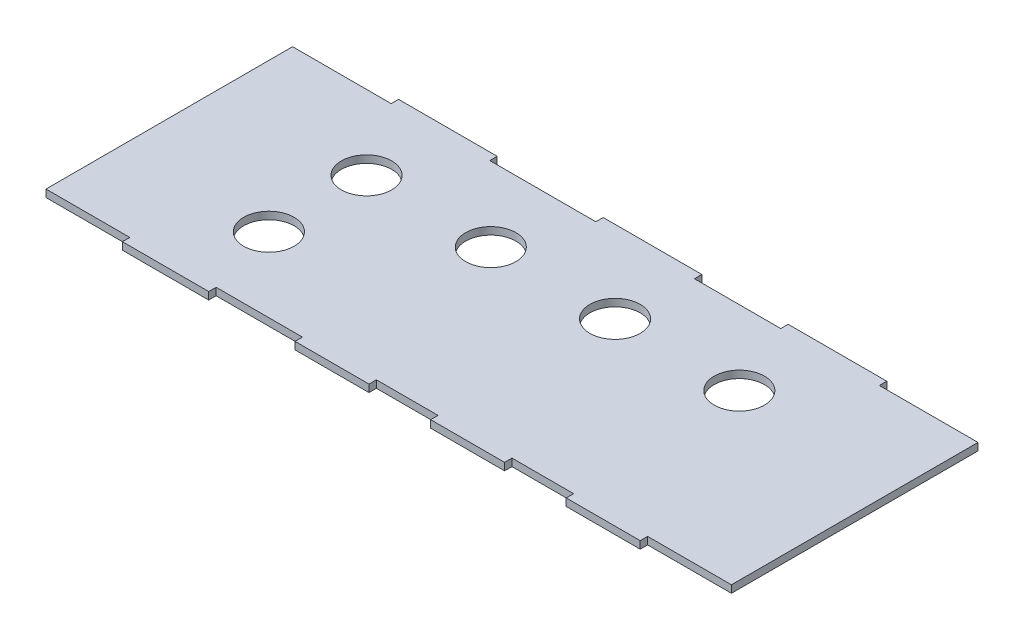
from build123d import *

# Parameters (mm, degrees)
SKETCH1_W           = 278
SKETCH1_H           = 100
BOSS_EXTRUDE1_DEPTH = 3
SKETCH2_W           = 40
SKETCH2_H           = 3
BOSS_EXTRUDE2_DEPTH = 3
SKETCH3_R           = 10.2
CUT_EXTRUDE1_DEPTH  = 3
SKETCH4_W           = 35
SKETCH4_H           = 3
SKETCH4_W_2         = 30
BOSS_EXTRUDE3_DEPTH = 3


with BuildPart() as part:
    # Sketch1 → Boss-Extrude1 (new body)
    with BuildSketch(Plane(origin=(0, 0, 0), x_dir=(1, 0, 0), z_dir=(0, 1, 0))):
        Rectangle(SKETCH1_W, SKETCH1_H)
    extrude(amount=BOSS_EXTRUDE1_DEPTH)

    # Sketch2 → Boss-Extrude2 (add)
    with BuildSketch(Plane(origin=(0, 0, -50), x_dir=(-1, 0, 0), z_dir=(0, 0, -1))):
        with Locations((-79, 1.5)):
            Rectangle(SKETCH2_W, SKETCH2_H)
        with Locations((-4, 1.5)):
            Rectangle(SKETCH2_W, SKETCH2_H)
        with Locations((79, 1.5)):
            Rectangle(SKETCH2_W, SKETCH2_H)
    extrude(amount=BOSS_EXTRUDE2_DEPTH)

    # Sketch3 → Cut-Extrude1 (cut)
    with BuildSketch(Plane(origin=(0, 3, 0), x_dir=(1, 0, 0), z_dir=(0, 1, 0))):
        with Locations(Location((72.4, 19.8, 0), (0, 0, 270))):
            Circle(SKETCH3_R)
        with Locations(Location((-78.8, -19.8, 0), (0, 0, 270))):
            Circle(SKETCH3_R)
        with Locations(Location((22, 19.8, 0), (0, 0, 270))):
            Circle(SKETCH3_R)
        with Locations(Location((-28.4, 19.8, 0), (0, 0, 270))):
            Circle(SKETCH3_R)
        with Locations(Location((-78.8, 19.8, 0), (0, 0, 270))):
            Circle(SKETCH3_R)
    extrude(amount=-CUT_EXTRUDE1_DEPTH, mode=Mode.SUBTRACT)

    # Sketch4 → Boss-Extrude3 (add)
    with BuildSketch(Plane.XY.offset(50)):
        with Locations((-87.5, 1.5)):
            Rectangle(SKETCH4_W, SKETCH4_H)
        with Locations((-20, 1.5)):
            Rectangle(SKETCH4_W_2, SKETCH4_H)
        with Locations((35, 1.5)):
            Rectangle(SKETCH4_W_2, SKETCH4_H)
        with Locations((90, 1.5)):
            Rectangle(SKETCH4_W_2, SKETCH4_H)
    extrude(amount=BOSS_EXTRUDE3_DEPTH)


solid = part.part
